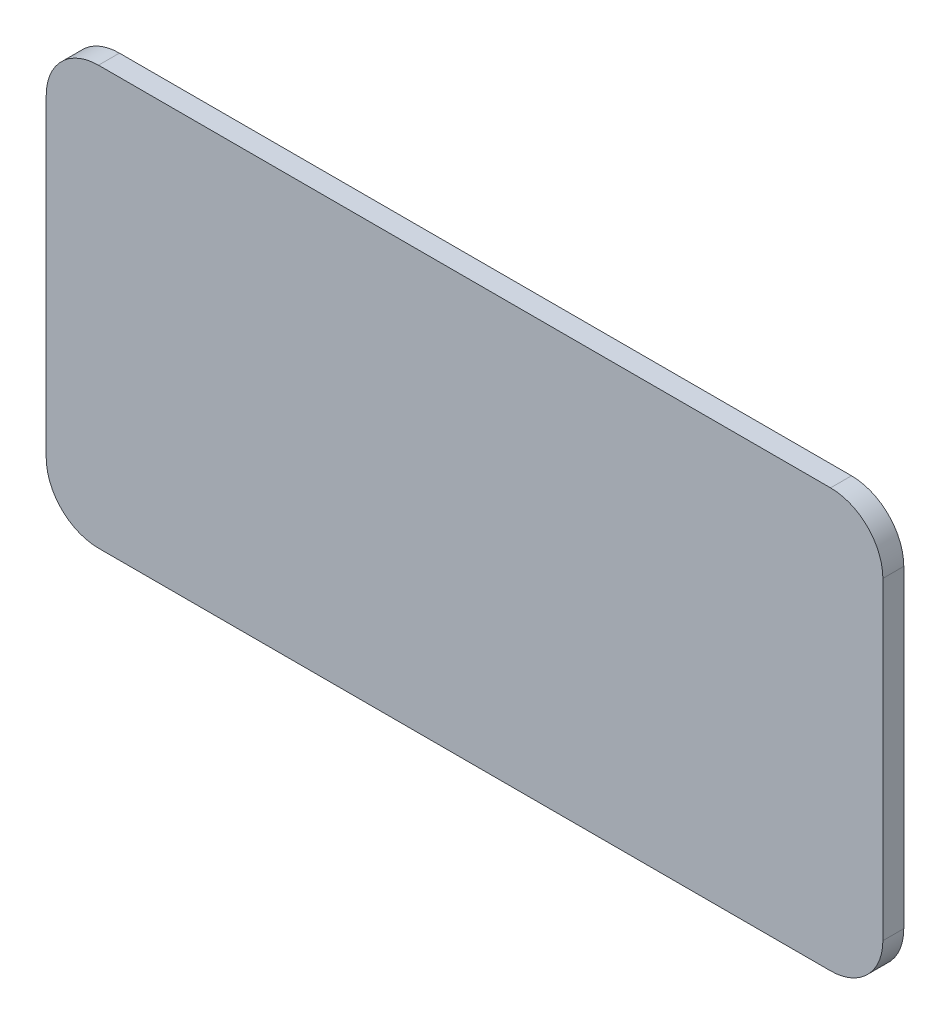
from build123d import *

# Parameters (mm, degrees)
EXTRUDE_1_DEPTH = 2
FILLET_1_R      = 5


with BuildPart() as part:
    # Эскиз1 → Бобышка-Вытянуть1 (new body)
    with BuildSketch(Plane.XY):
        with BuildLine():
            Line((-35, -20), (35, -20))
            ThreePointArc((35, -20), (38.535533906, -18.535533906), (40, -15))
            Line((40, -15), (40, 20))
            Line((40, 20), (-40, 20))
            Line((-40, 20), (-40, -15))
            ThreePointArc((-40, -15), (-38.535533906, -18.535533906), (-35, -20))
        make_face()
    extrude(amount=EXTRUDE_1_DEPTH)

    # Скругление1
    fillet_1_edges = [part.edges().sort_by_distance(p)[0] for p in [
        (-40, 20, 1),
        (40, 20, 1),
    ]]
    fillet(fillet_1_edges, radius=FILLET_1_R)


solid = part.part
